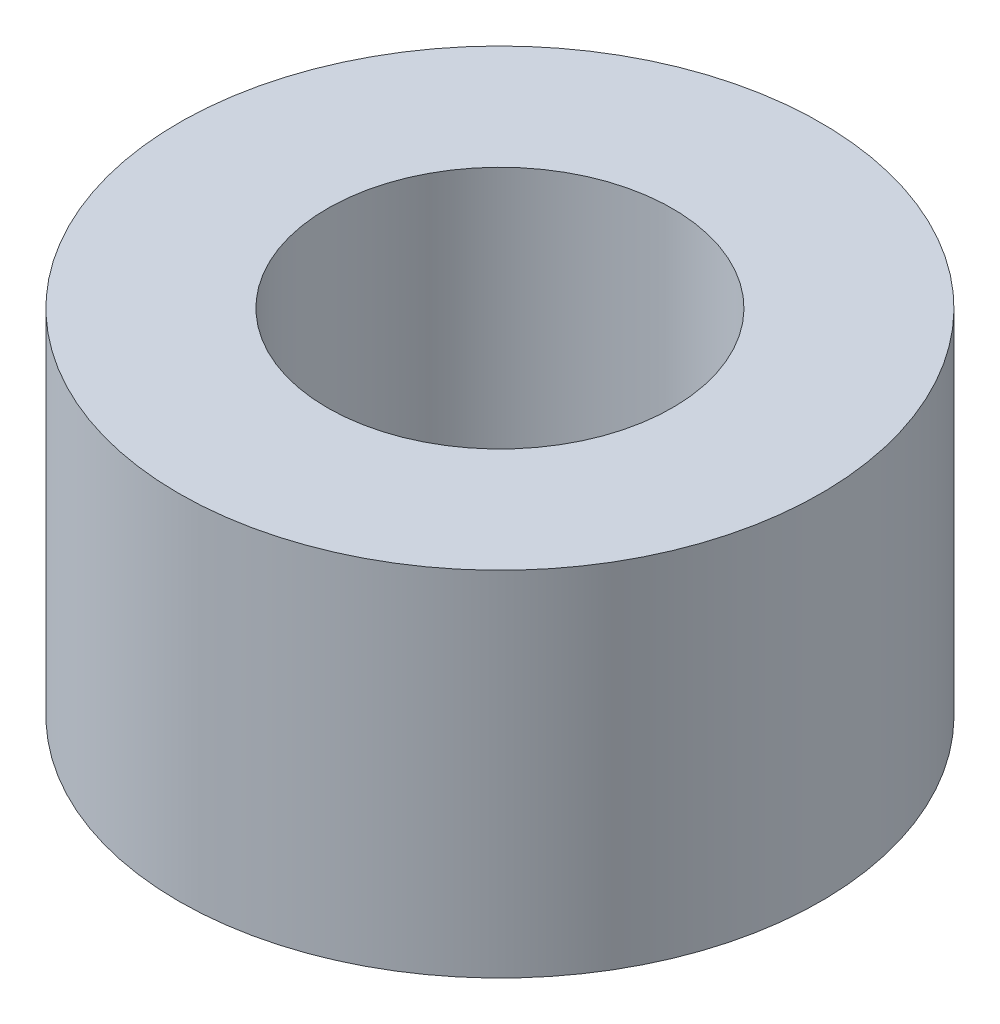
from build123d import *

# Parameters (mm, degrees)
SPACER_SKETCH_R   = 4
SPACER_SKETCH_R_2 = 2.15
SPACER_DEPTH      = 2.2


with BuildPart() as part:
    # Spacer Sketch → Spacer (new, symmetric)
    with BuildSketch(Plane(origin=(0, 10.1625, 0), x_dir=(1, 0, 0), z_dir=(0, 1, 0))):
        with Locations((0, -15.04)):
            Circle(SPACER_SKETCH_R)
        with Locations((0, -15.04)):
            Circle(SPACER_SKETCH_R_2, mode=Mode.SUBTRACT)
    extrude(amount=SPACER_DEPTH, both=True)


solid = part.part
